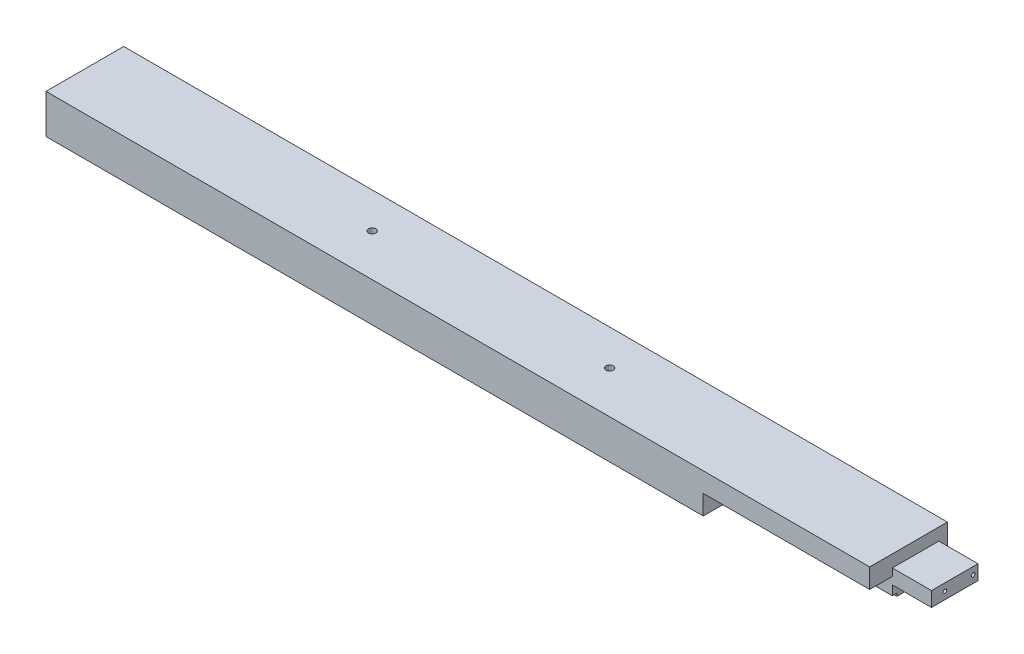
from build123d import *

# Parameters (mm, degrees)
SKETCH1_W           = 2136.775
SKETCH1_H           = 201.6125
BOSS_EXTRUDE1_DEPTH = 101.6
SKETCH2_R           = 9.525
CUT_EXTRUDE1_DEPTH  = 1078.931496059
SKETCH3_R           = 4.7625
BOSS_EXTRUDE2_DEPTH = 101.6
CUT_EXTRUDE2_DEPTH  = 431.8
SKETCH5_R           = 11.1125
CUT_EXTRUDE3_DEPTH  = 69.85


with BuildPart() as part:
    # Sketch1 → Boss-Extrude1 (new body)
    with BuildSketch(Plane(origin=(0, 0, 0), x_dir=(1, 0, 0), z_dir=(0, 1, 0))):
        Rectangle(SKETCH1_W, SKETCH1_H)
    extrude(amount=BOSS_EXTRUDE1_DEPTH)

    # Sketch2 → Cut-Extrude1 (cut, through all)
    with BuildSketch(Plane(origin=(0, 101.6, 0), x_dir=(1, 0, 0), z_dir=(0, 1, 0))):
        with Locations((-331.7875, 8.73125)):
            Circle(SKETCH2_R)
        with Locations((284.1625, 8.73125)):
            Circle(SKETCH2_R)
    extrude(amount=-CUT_EXTRUDE1_DEPTH, mode=Mode.SUBTRACT)

    # Sketch3 → Boss-Extrude2 (add)
    with BuildSketch(Plane(origin=(1068.3875, 0, 0), x_dir=(0, 0, -1), z_dir=(1, 0, 0))):
        Polygon((78.58125, 69.85), (-42.06875, 69.85), (-42.06875, 50.8), (-42.06875, 31.75), (78.58125, 31.75), align=None)
        with Locations((-7.14375, 50.8)):
            Circle(SKETCH3_R, mode=Mode.SUBTRACT)
        with Locations((65.88125, 50.8)):
            Circle(SKETCH3_R, mode=Mode.SUBTRACT)
    extrude(amount=BOSS_EXTRUDE2_DEPTH)

    # Sketch3<3> → Cut-Extrude2 (cut)
    with BuildSketch(Plane(origin=(1068.3875, 0, 0), x_dir=(0, 0, -1), z_dir=(1, 0, 0))):
        Polygon((-42.06875, 31.75), (-42.06875, 50.8), (-100.80625, 50.8), (-100.80625, 0), (-29.932015023, 0), (-29.932015023, 7.312255735), (-42.06875, 7.312255735), align=None)
    extrude(amount=-CUT_EXTRUDE2_DEPTH, mode=Mode.SUBTRACT)

    # Sketch5 → Cut-Extrude3 (cut)
    with BuildSketch(Plane.XZ):
        with Locations((1009.306684953, 7.14375)):
            Circle(SKETCH5_R)
        with Locations((1009.306684953, -65.88125)):
            Circle(SKETCH5_R)
    extrude(amount=-CUT_EXTRUDE3_DEPTH, mode=Mode.SUBTRACT)


solid = part.part
